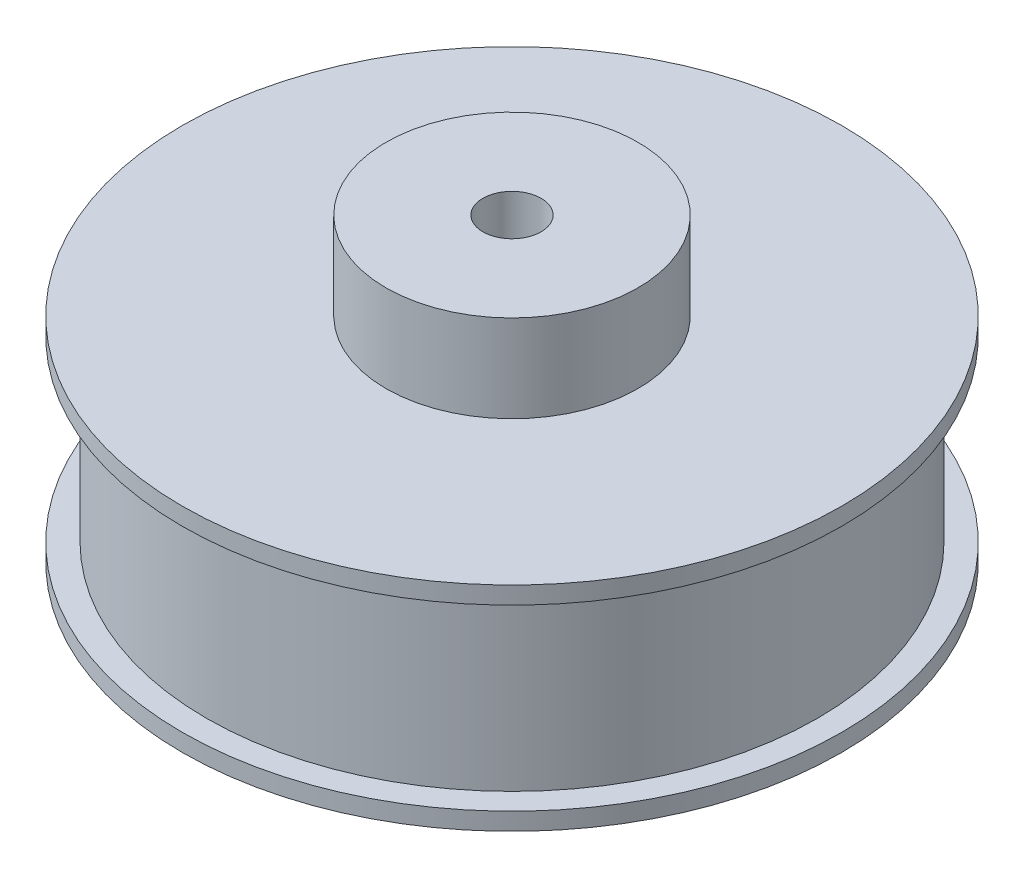
from build123d import *


with BuildPart() as part:
    # Sketch1 → Revolve1 (revolve)
    with BuildSketch(Plane.XY, mode=Mode.PRIVATE) as revolve1_sk:
        Polygon((3, 31), (13, 31), (13, 22), (34, 22), (34, 20.2), (31.5, 20.2), (31.5, 1.8), (34, 1.8), (34, 0), (3, 0), align=None)
    revolve(revolve1_sk.sketch.rotate(Axis((0, 51.174824137, 0), (0, -1, 0)), 90), axis=Axis((0, 51.174824137, 0), (0, -1, 0)))


solid = part.part
